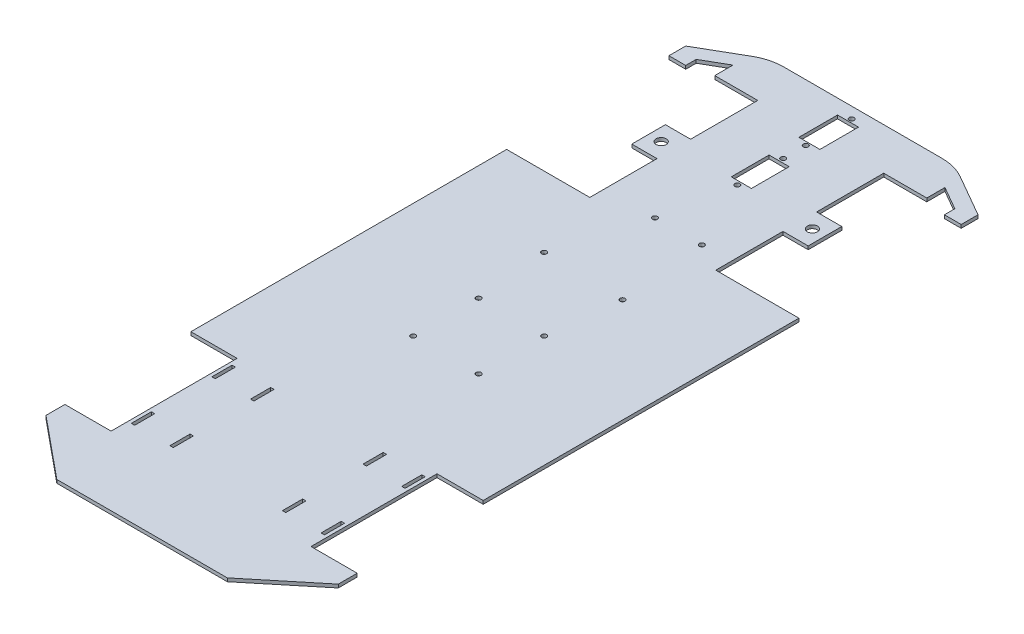
from build123d import *

# Parameters (mm, degrees)
SKETCH1_R                = 3
SKETCH1_R_2              = 1.5
SKETCH1_W                = 2
SKETCH1_H                = 12
SKETCH1_W_2              = 12
SKETCH1_H_2              = 22.5
SKETCH1_W_3              = 12.5
SKETCH1_H_3              = 23
BOSS_EXTRUDE2_DEPTH      = 2
F_3_0_3_DIAMETER_HOLE1_D = 3
F_3_0_3_DIAMETER_HOLE2_D = 3


with BuildPart() as part:
    # Sketch1 → Boss-Extrude2 (new body)
    with BuildSketch(Plane(origin=(0, 0, 0), x_dir=(1, 0, 0), z_dir=(0, 1, 0))):
        with BuildLine():
            Line((47.026548113, 113.484810936), (-47.026548113, 113.484810936))
            ThreePointArc((-47.026548113, 113.484810936), (-54.774215022, 112.467109973), (-61.996228059, 109.483054768))
            Line((-61.996228059, 109.483054768), (-87, 95.085987572))
            Line((-87, 95.085987572), (-87, 85.085987572))
            Line((-87, 85.085987572), (-77, 85.085987572))
            Line((-77, 85.085987572), (-77, 91.313276712))
            Line((-77, 91.313276712), (-63.105457223, 99.313696268))
            Line((-63.105457223, 99.313696268), (-63.105457223, 88.484810936))
            Line((-63.105457223, 88.484810936), (-37.5, 88.484810936))
            Line((-37.5, 88.484810936), (-37.5, 48.484810936))
            Line((-37.5, 48.484810936), (-52.5, 48.484810936))
            Line((-52.5, 48.484810936), (-52.5, 28.484810936))
            Line((-52.5, 28.484810936), (-37.5, 28.484810936))
            Line((-37.5, 28.484810936), (-37.5, -11.515189064))
            Line((-37.5, -11.515189064), (-87, -11.515189064))
            Line((-87, -11.515189064), (-87, -199.484504535))
            Line((-87, -199.484504535), (-59.5, -199.484504535))
            Line((-59.5, -199.484504535), (-59.5, -274.484504535))
            Line((-59.5, -274.484504535), (-87, -274.484504535))
            Line((-87, -274.484504535), (-87, -275.742175661))
            Line((-87, -275.742175661), (-87, -285.742175661))
            Line((-87, -285.742175661), (-50.740945714, -315.558389864))
            Line((-50.740945714, -315.558389864), (50.740945714, -315.558389864))
            Line((50.740945714, -315.558389864), (87, -285.742175661))
            Line((87, -285.742175661), (87, -275.742175661))
            Line((87, -275.742175661), (87, -274.484504535))
            Line((87, -274.484504535), (59.5, -274.484504535))
            Line((59.5, -274.484504535), (59.5, -199.484504535))
            Line((59.5, -199.484504535), (87, -199.484504535))
            Line((87, -199.484504535), (87, -11.515189064))
            Line((87, -11.515189064), (37.5, -11.515189064))
            Line((37.5, -11.515189064), (37.5, 28.484810936))
            Line((37.5, 28.484810936), (52.5, 28.484810936))
            Line((52.5, 28.484810936), (52.5, 48.484810936))
            Line((52.5, 48.484810936), (37.5, 48.484810936))
            Line((37.5, 48.484810936), (37.5, 88.484810936))
            Line((37.5, 88.484810936), (63.105457223, 88.484810936))
            Line((63.105457223, 88.484810936), (63.105457223, 99.313696268))
            Line((63.105457223, 99.313696268), (77, 91.313276712))
            Line((77, 91.313276712), (77, 85.085987572))
            Line((77, 85.085987572), (87, 85.085987572))
            Line((87, 85.085987572), (87, 95.085987572))
            Line((87, 95.085987572), (61.996228059, 109.483054768))
            ThreePointArc((61.996228059, 109.483054768), (54.774215022, 112.467109973), (47.026548113, 113.484810936))
        make_face()
        with Locations(Location((-45, 38.484810936, 0), (0, 0, 270))):
            Circle(SKETCH1_R, mode=Mode.SUBTRACT)
        with Locations(Location((45, 38.484810936, 0), (0, 0, 90))):
            Circle(SKETCH1_R, mode=Mode.SUBTRACT)
        with Locations(Location((0, 38.804810936, 0), (0, 0, 270))):
            Circle(SKETCH1_R_2, mode=Mode.SUBTRACT)
        with Locations(Location((0, 66.104810936, 0), (0, 0, 90))):
            Circle(SKETCH1_R_2, mode=Mode.SUBTRACT)
        with Locations(Location((0, 79.56209058, 0), (0, 0, 270))):
            Circle(SKETCH1_R_2, mode=Mode.SUBTRACT)
        with Locations(Location((0, 106.86209058, 0), (0, 0, 90))):
            Circle(SKETCH1_R_2, mode=Mode.SUBTRACT)
        with Locations((-33.5, -258.484504535)):
            Rectangle(SKETCH1_W, SKETCH1_H, mode=Mode.SUBTRACT)
        with Locations((-56.5, -258.484504535)):
            Rectangle(SKETCH1_W, SKETCH1_H, mode=Mode.SUBTRACT)
        with Locations((-33.5, -210.484504535)):
            Rectangle(SKETCH1_W, SKETCH1_H, mode=Mode.SUBTRACT)
        with Locations((-56.5, -210.484504535)):
            Rectangle(SKETCH1_W, SKETCH1_H, mode=Mode.SUBTRACT)
        with Locations((56.5, -210.484504535)):
            Rectangle(SKETCH1_W, SKETCH1_H, mode=Mode.SUBTRACT)
        with Locations((33.5, -210.484504535)):
            Rectangle(SKETCH1_W, SKETCH1_H, mode=Mode.SUBTRACT)
        with Locations((56.5, -258.484504535)):
            Rectangle(SKETCH1_W, SKETCH1_H, mode=Mode.SUBTRACT)
        with Locations((33.5, -258.484504535)):
            Rectangle(SKETCH1_W, SKETCH1_H, mode=Mode.SUBTRACT)
        with Locations((0, 52.454810936)):
            Rectangle(SKETCH1_W_2, SKETCH1_H_2, mode=Mode.SUBTRACT)
        with Locations((0, 93.21209058)):
            Rectangle(SKETCH1_W_3, SKETCH1_H_3, mode=Mode.SUBTRACT)
    extrude(amount=BOSS_EXTRUDE2_DEPTH)

    # Ø3.0 (3) Diameter Hole1 (through all)
    with Locations(Plane(origin=(-77.532035134, 2, -197.100991793), x_dir=(1, 0, 0), z_dir=(0, 1, 0))):
        with Locations((97.86378973, -199.745008939), (69.96378973, -199.745008939), (54.76378973, -250.545008939), (102.56378973, -251.645008939)):
            Hole(F_3_0_3_DIAMETER_HOLE1_D / 2)

    # Ø3.0 (3) Diameter Hole2 (through all)
    with Locations(Plane(origin=(-77.532035134, 4, -197.100991793), x_dir=(1, 0, 0), z_dir=(0, 1, 0))):
        with Locations((97.918849389, -293.673103718), (58.918849389, -293.673103718), (58.918849389, -332.673103718), (97.918849389, -332.673103718)):
            Hole(F_3_0_3_DIAMETER_HOLE2_D / 2)


solid = part.part
